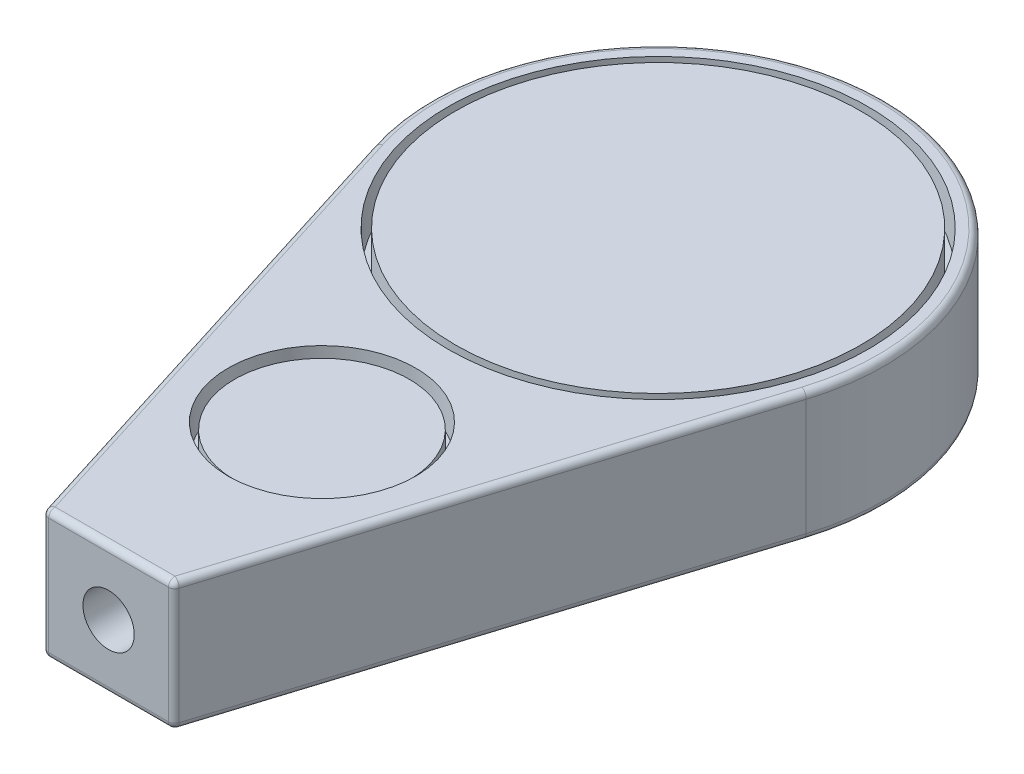
from build123d import *

# Parameters (mm, degrees)
SKETCH1_R                       = 35
BOSS_EXTRUDE1_DEPTH             = 20
SKETCH2_R                       = 32.5
CUT_EXTRUDE1_DEPTH              = 6.5
SKETCH3_R                       = 31.35
BOSS_EXTRUDE2_DEPTH             = 6.5
BOSS_EXTRUDE3_DEPTH             = 20
SKETCH14_R                      = 14.5
CUT_EXTRUDE2_DEPTH              = 5
SKETCH15_R                      = 13.5
BOSS_EXTRUDE4_DEPTH             = 4
TAP_DRILL_FOR_3_8_16_TAP1_D     = 7.9375
TAP_DRILL_FOR_3_8_16_TAP1_DEPTH = 40
TAP_DRILL_FOR_3_8_16_TAP1_TIP   = 2.384665582
FILLET1_R                       = 1


with BuildPart() as part:
    # Sketch1 → Boss-Extrude1 (new body)
    with BuildSketch(Plane(origin=(0, 0, 0), x_dir=(1, 0, 0), z_dir=(0, 1, 0))):
        with Locations(Location((0, 0, 0), (0, 0, 270))):
            Circle(SKETCH1_R)
    extrude(amount=BOSS_EXTRUDE1_DEPTH)

    # Sketch2 → Cut-Extrude1 (cut)
    with BuildSketch(Plane(origin=(0, 20, 0), x_dir=(1, 0, 0), z_dir=(0, 1, 0))):
        with Locations(Location((0, 0, 0), (0, 0, 270))):
            Circle(SKETCH2_R)
    extrude(amount=-CUT_EXTRUDE1_DEPTH, mode=Mode.SUBTRACT)

    # Sketch3 → Boss-Extrude2 (add)
    with BuildSketch(Plane(origin=(0, 13.5, 0), x_dir=(1, 0, 0), z_dir=(0, 1, 0))):
        with Locations(Location((0, 0, 0), (0, 0, 270))):
            Circle(SKETCH3_R)
    extrude(amount=BOSS_EXTRUDE2_DEPTH)

    # Sketch8 → Boss-Extrude3 (add)
    with BuildSketch(Plane(origin=(0, 0, 0), x_dir=(1, 0, 0), z_dir=(0, 1, 0))):
        with BuildLine():
            ThreePointArc((33.393164213, -10.483157151), (0, -35), (-33.393164213, -10.483157151))
            Line((-33.393164213, -10.483157151), (-10, -85))
            Line((-10, -85), (10, -85))
            Line((10, -85), (33.393164213, -10.483157151))
        make_face()
    extrude(amount=BOSS_EXTRUDE3_DEPTH)

    # Sketch14 → Cut-Extrude2 (cut)
    with BuildSketch(Plane(origin=(0, 20, 0), x_dir=(1, 0, 0), z_dir=(0, 1, 0))):
        with Locations(Location((0, -52, 0), (0, 0, 270))):
            Circle(SKETCH14_R)
    extrude(amount=-CUT_EXTRUDE2_DEPTH, mode=Mode.SUBTRACT)

    # Sketch15 → Boss-Extrude4 (add)
    with BuildSketch(Plane(origin=(0, 15, 0), x_dir=(1, 0, 0), z_dir=(0, 1, 0))):
        with Locations(Location((0, -52, 0), (0, 0, 270))):
            Circle(SKETCH15_R)
    extrude(amount=BOSS_EXTRUDE4_DEPTH)

    # Tap Drill for 3/8-16 Tap1
    with Locations(Plane.XY.offset(85)):
        with Locations((0, 10)):
            Hole(TAP_DRILL_FOR_3_8_16_TAP1_D / 2, depth=TAP_DRILL_FOR_3_8_16_TAP1_DEPTH)
            with Locations((0, 0, -(TAP_DRILL_FOR_3_8_16_TAP1_DEPTH + TAP_DRILL_FOR_3_8_16_TAP1_TIP / 2))):  # 118° drill point
                Cone(0, TAP_DRILL_FOR_3_8_16_TAP1_D / 2, TAP_DRILL_FOR_3_8_16_TAP1_TIP, mode=Mode.SUBTRACT)

    # Fillet1
    fillet1_edges = [part.edges().sort_by_distance(p)[0] for p in [
        (0, 0, -35),
        (-21.696582106, 0, 47.741578576),
        (-10, 10, 85),
        (0, 0, 85),
        (10, 10, 85),
        (21.696582106, 0, 47.741578576),
        (-21.696582106, 20, 47.741578576),
        (0, 20, 85),
        (21.696582106, 20, 47.741578576),
        (0, 20, -35),
    ]]
    fillet(fillet1_edges, radius=FILLET1_R)


solid = part.part
